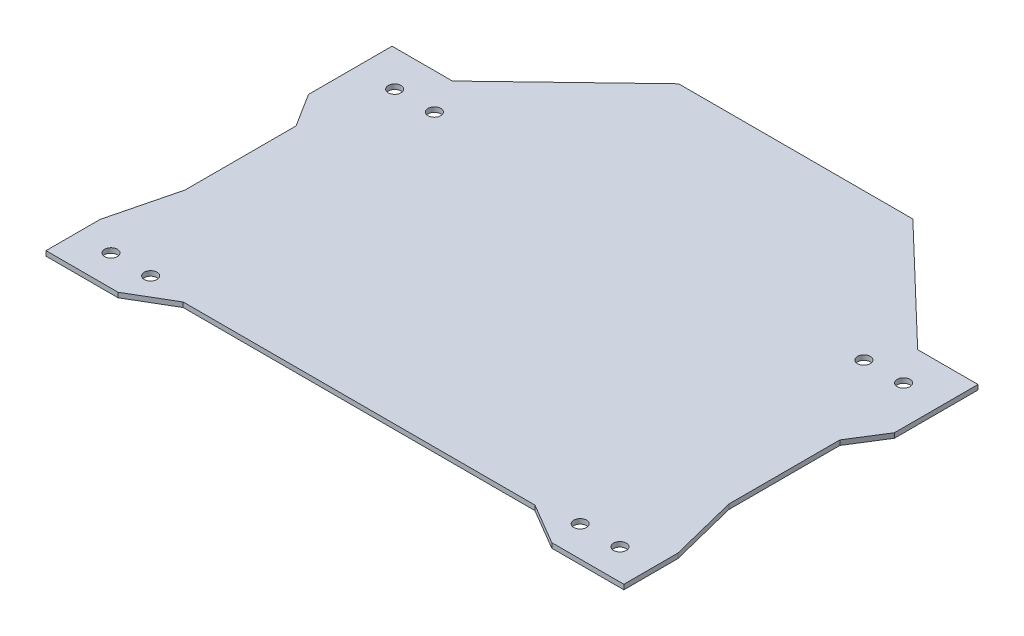
from build123d import *

# Parameters (mm, degrees)
SKETCH1_R           = 2.25
BOSS_EXTRUDE1_DEPTH = 1.7


with BuildPart() as part:
    # Sketch1 → Boss-Extrude1 (new body)
    with BuildSketch(Plane(origin=(0, 0, 0), x_dir=(1, 0, 0), z_dir=(0, 1, 0))):
        Polygon((41.275, 184.522975959), (-41.275, 184.522975959), (-82, 145.494175959), (-103.26875, 145.494175959), (-103.26875, 116.051129389), (-95.84375, 104.219175959), (-95.84375, 65.098975959), (-101.84375, 41.144175959), (-101.84375, 22.094175959), (-76.44375, 22.094175959), (-61.99375, 30.598975959), (61.99375, 30.598975959), (76.44375, 22.094175959), (101.84375, 22.094175959), (101.84375, 41.144175959), (95.84375, 65.098975959), (95.84375, 104.219175959), (103.26875, 116.051129389), (103.26875, 145.494175959), (82, 145.494175959), align=None)
        with Locations(Location((-89.69375, 32.848975959, 0), (0, 0, 270))):
            Circle(SKETCH1_R, mode=Mode.SUBTRACT)
        with Locations(Location((-75.69375, 32.848975959, 0), (0, 0, 270))):
            Circle(SKETCH1_R, mode=Mode.SUBTRACT)
        with Locations(Location((-89.69375, 132.844175959, 0), (0, 0, 270))):
            Circle(SKETCH1_R, mode=Mode.SUBTRACT)
        with Locations(Location((-75.69375, 132.844175959, 0), (0, 0, 270))):
            Circle(SKETCH1_R, mode=Mode.SUBTRACT)
        with Locations(Location((75.69375, 32.848975959, 0), (0, 0, 90))):
            Circle(SKETCH1_R, mode=Mode.SUBTRACT)
        with Locations(Location((89.69375, 32.848975959, 0), (0, 0, 90))):
            Circle(SKETCH1_R, mode=Mode.SUBTRACT)
        with Locations(Location((75.69375, 132.844175959, 0), (0, 0, 90))):
            Circle(SKETCH1_R, mode=Mode.SUBTRACT)
        with Locations(Location((89.69375, 132.844175959, 0), (0, 0, 90))):
            Circle(SKETCH1_R, mode=Mode.SUBTRACT)
    extrude(amount=BOSS_EXTRUDE1_DEPTH)


solid = part.part
